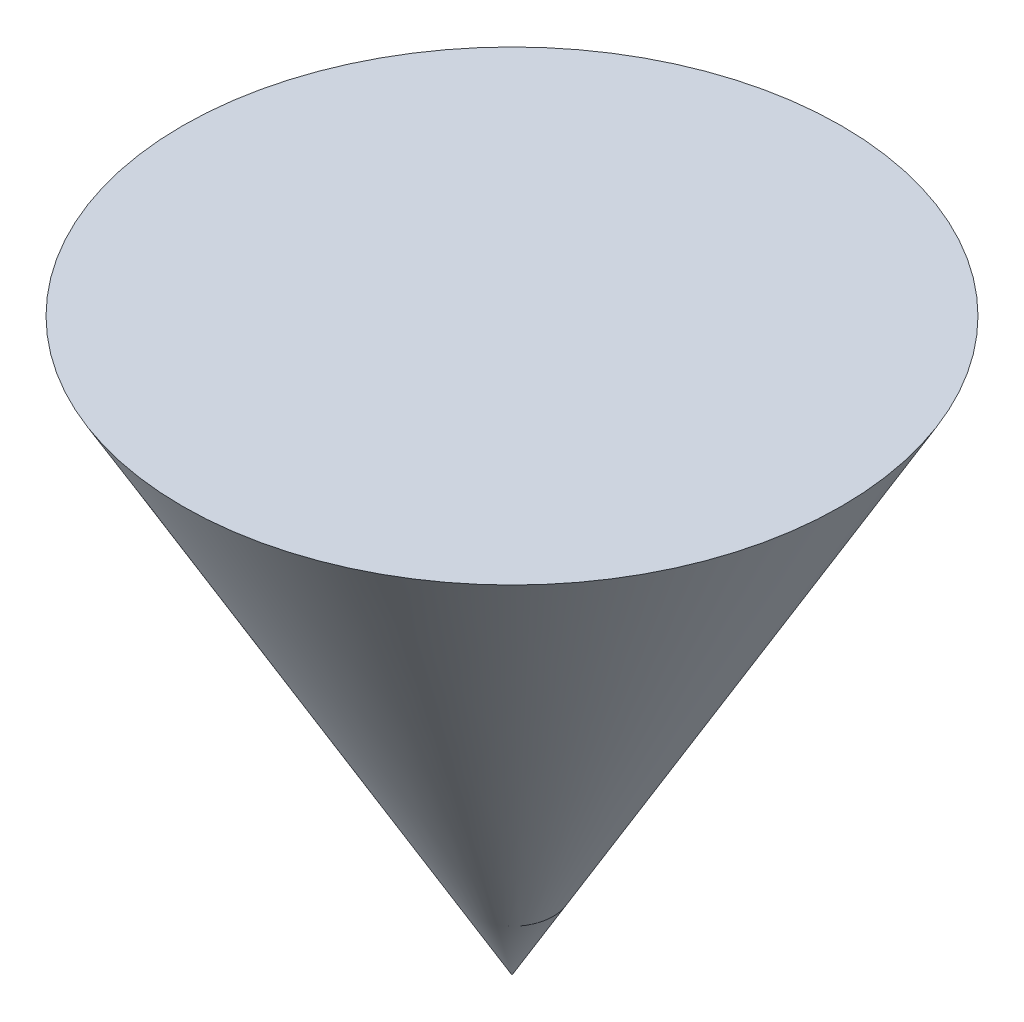
from build123d import *


with BuildPart() as part:
    # Sketch1 → camera FOV (revolve)
    with BuildSketch(Plane.XY, mode=Mode.PRIVATE) as camera_fov_sk:
        Polygon((0, 0), (35.460203523, 61.418874148), (0, 61.418874148), align=None)
    revolve(camera_fov_sk.sketch.rotate(Axis((0, 1.161274283, 0), (0, 1, 0)), 270), axis=Axis((0, 1.161274283, 0), (0, 1, 0)))


solid = part.part
